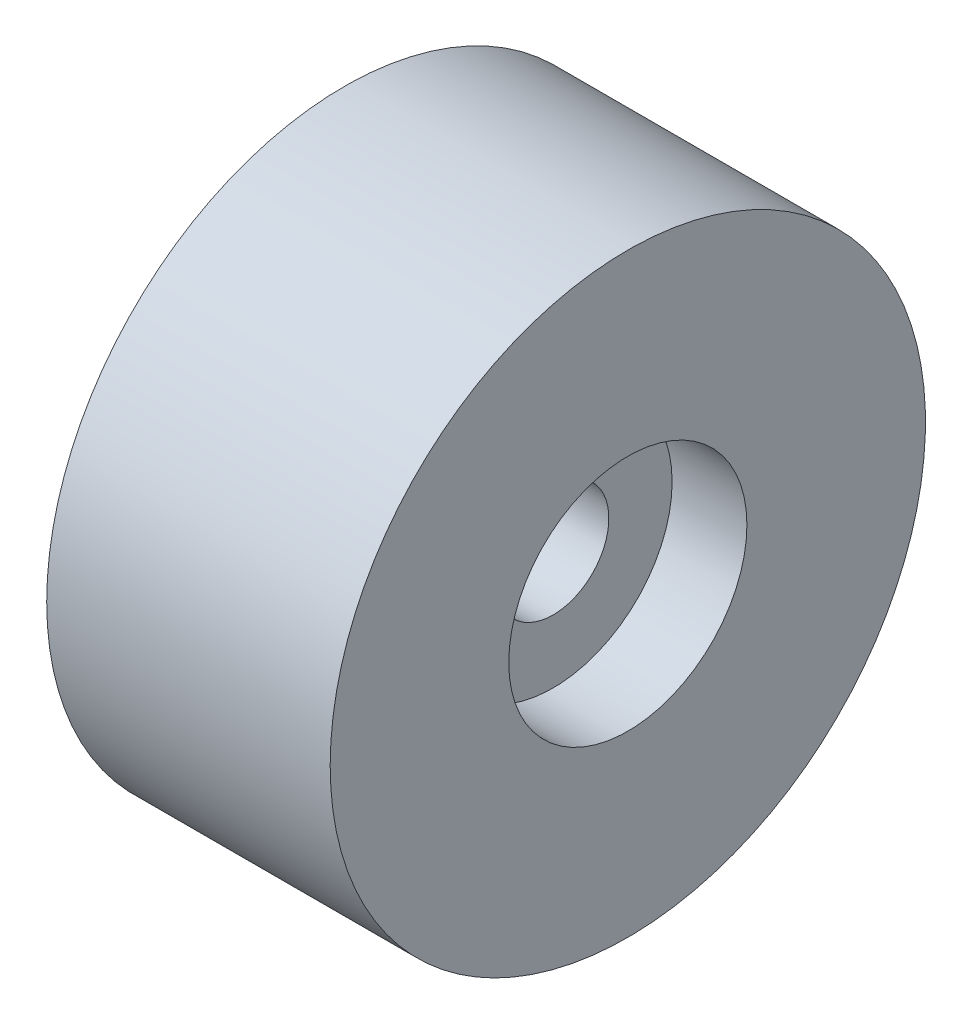
from build123d import *


with BuildPart() as part:
    # Sketch1 → Revolve1 (revolve)
    with BuildSketch(Plane.XY, mode=Mode.PRIVATE) as revolve1_sk:
        Polygon((0, -25), (0, -133.35), (-63.5, -133.35), (-63.5, -53.35), (-30, -53.35), (-30, -25), align=None)
    revolve1 = revolve(revolve1_sk.sketch.rotate(Axis((-62.857142857, 0, 0), (1, 0, 0)), 270), axis=Axis((-62.857142857, 0, 0), (1, 0, 0)))

    # Mirror1: Revolve1 across plane
    add(revolve1.mirror(Plane(origin=(0, 0, 0), x_dir=(0, 0, 1), z_dir=(1, 0, 0))))


solid = part.part
